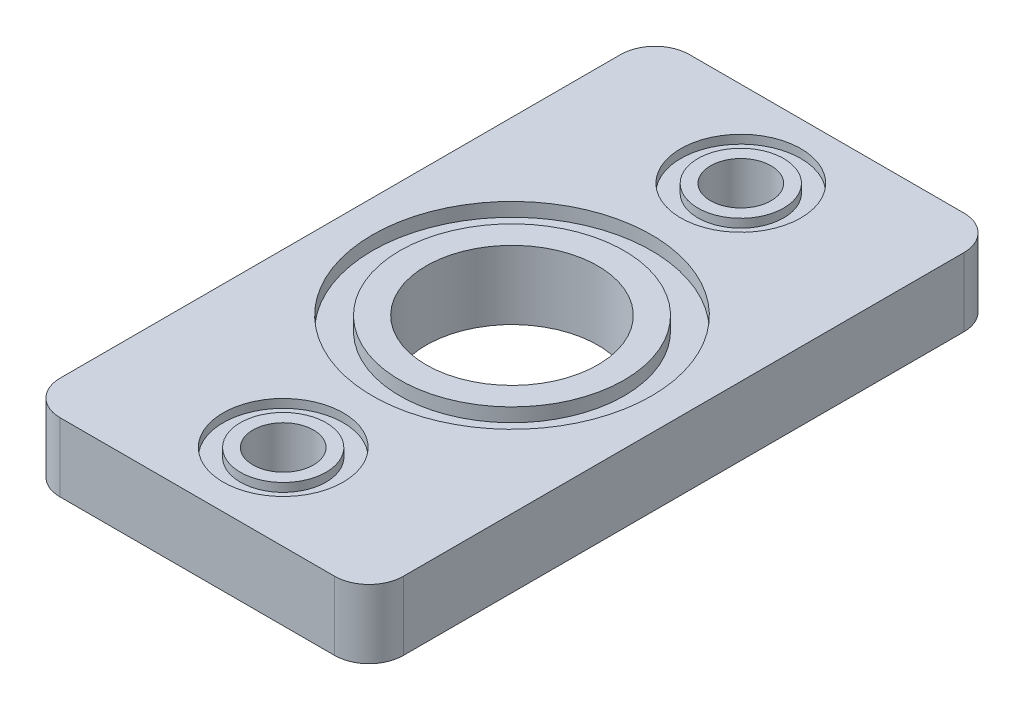
from build123d import *

# Parameters (mm, degrees)
ESQUISSE1_W                = 30
ESQUISSE1_H                = 55
PLAQUE_PLEXI_DEPTH         = 6
PASSAGE_JAUGE_LAITON_REACH = 33.894
ESQUISSE5_R                = 7.5
PASSAGE_CROU_M5_REACH      = 33.894
ESQUISSE6_R                = 2.65
ESQUISSE2_R                = 12.2
ESQUISSE2_R_2              = 9.8
GORGE_JOINT_22MM_DEPTH     = 1.2
ESQUISSE7_R                = 5.25
ESQUISSE7_R_2              = 3.75
GORGE_JOINT_9MM_DEPTH      = 0.75
CONG_1_R                   = 3


with BuildPart() as part:
    # Esquisse1 → Plaque Plexi (new body)
    with BuildSketch(Plane(origin=(0, 0, 0), x_dir=(1, 0, 0), z_dir=(0, 1, 0))):
        Rectangle(ESQUISSE1_W, ESQUISSE1_H)
    extrude(amount=PLAQUE_PLEXI_DEPTH)

    # Esquisse5 → Passage Jauge Laiton (cut, up to next)
    with BuildSketch(Plane(origin=(0, 6, 0), x_dir=(1, 0, 0), z_dir=(0, 1, 0)), mode=Mode.PRIVATE) as passage_jauge_laiton_sk1:
        with Locations(Location((0, 0, 0), (0, 0, 270))):
            Circle(ESQUISSE5_R)
    passage_jauge_laiton_tool1 = extrude(passage_jauge_laiton_sk1.sketch, amount=-PASSAGE_JAUGE_LAITON_REACH, mode=Mode.PRIVATE) & part.part
    add(passage_jauge_laiton_tool1.solids().sort_by_distance((0, 6, 0))[0], mode=Mode.SUBTRACT)

    # Esquisse6 → Passage écrou M5 (cut, up to next)
    with BuildSketch(Plane(origin=(0, 6, 0), x_dir=(1, 0, 0), z_dir=(0, 1, 0)), mode=Mode.PRIVATE) as passage_crou_m5_sk1:
        with Locations(Location((0, 20, 0), (0, 0, 270))):
            Circle(ESQUISSE6_R)
    passage_crou_m5_tool1 = extrude(passage_crou_m5_sk1.sketch, amount=-PASSAGE_CROU_M5_REACH, mode=Mode.PRIVATE) & part.part
    # Esquisse6 → Passage écrou M5 (cut, up to next)
    with BuildSketch(Plane(origin=(0, 6, 0), x_dir=(1, 0, 0), z_dir=(0, 1, 0)), mode=Mode.PRIVATE) as passage_crou_m5_sk2:
        with Locations(Location((0, -20, 0), (0, 0, 270))):
            Circle(ESQUISSE6_R)
    passage_crou_m5_tool2 = extrude(passage_crou_m5_sk2.sketch, amount=-PASSAGE_CROU_M5_REACH, mode=Mode.PRIVATE) & part.part
    add(passage_crou_m5_tool1.solids().sort_by_distance((0, 6, -20))[0], mode=Mode.SUBTRACT)
    add(passage_crou_m5_tool2.solids().sort_by_distance((0, 6, 20))[0], mode=Mode.SUBTRACT)

    # Esquisse2 → Gorge_Joint_22mm (cut)
    with BuildSketch(Plane(origin=(0, 6, 0), x_dir=(1, 0, 0), z_dir=(0, 1, 0))):
        Circle(ESQUISSE2_R)
        Circle(ESQUISSE2_R_2, mode=Mode.SUBTRACT)
    extrude(amount=-GORGE_JOINT_22MM_DEPTH, mode=Mode.SUBTRACT)

    # Esquisse7 → Gorge_Joint_9mm (cut)
    # profile 1 of 2: a face of its own
    with BuildSketch(Plane(origin=(0, 6, 0), x_dir=(1, 0, 0), z_dir=(0, 1, 0))):
        with Locations((0, -20)):
            Circle(ESQUISSE7_R)
        with Locations((0, -20)):
            Circle(ESQUISSE7_R_2, mode=Mode.SUBTRACT)
    # profile 2 of 2: a face of its own
    with BuildSketch(Plane(origin=(0, 6, 0), x_dir=(1, 0, 0), z_dir=(0, 1, 0))):
        with Locations((0, 20)):
            Circle(ESQUISSE7_R)
        with Locations((0, 20)):
            Circle(ESQUISSE7_R_2, mode=Mode.SUBTRACT)
    extrude(amount=-GORGE_JOINT_9MM_DEPTH, mode=Mode.SUBTRACT)

    # Congé1
    cong_1_edges = [part.edges().sort_by_distance(p)[0] for p in [
        (-15, 3, -27.5),
        (15, 3, -27.5),
        (15, 3, 27.5),
        (-15, 3, 27.5),
    ]]
    fillet(cong_1_edges, radius=CONG_1_R)


solid = part.part
